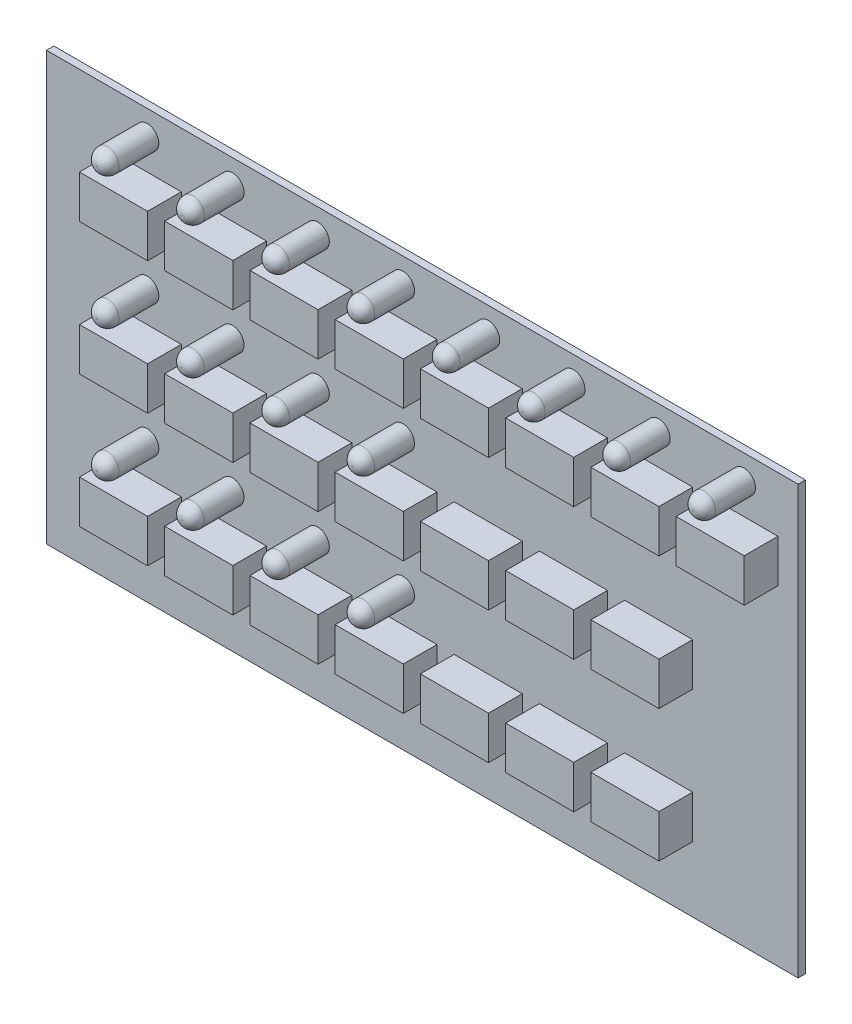
from build123d import *

# Parameters (mm, degrees)
SKETCH1_W                       = 162.5854
SKETCH1_H                       = 92.5068
BOARD_DEPTH                     = 1.592072
SKETCH17_R                      = 2.5
LED_KINGBRIGHT_3P_2P54_16_DEPTH = 11
FILLET1_R                       = 2.4
SKETCH18_W                      = 14.732
SKETCH18_H                      = 9.271
SWITCH_MCDTS2_1_DEPTH           = 7.3000108
SKETCH19_W                      = 14.732
SKETCH19_H                      = 9.271
SWITCH_MCDTS2_2_DEPTH           = 7.3000108
SKETCH20_W                      = 14.732
SKETCH20_H                      = 9.271
SWITCH_MCDTS2_3_DEPTH           = 7.3000108
SKETCH21_W                      = 14.732
SKETCH21_H                      = 9.271
SWITCH_MCDTS2_4_DEPTH           = 7.3000108
SKETCH22_W                      = 14.732
SKETCH22_H                      = 9.271
SWITCH_MCDTS2_5_DEPTH           = 7.3000108
SKETCH23_W                      = 14.732
SKETCH23_H                      = 9.271
SWITCH_MCDTS2_6_DEPTH           = 7.3000108
SKETCH24_W                      = 14.732
SKETCH24_H                      = 9.271
SWITCH_MCDTS2_7_DEPTH           = 7.3000108
SKETCH25_W                      = 14.732
SKETCH25_H                      = 9.271
SWITCH_MCDTS2_8_DEPTH           = 7.3000108
SKETCH26_W                      = 14.732
SKETCH26_H                      = 9.271
SWITCH_MCDTS2_9_DEPTH           = 7.3000108
SKETCH27_W                      = 14.732
SKETCH27_H                      = 9.271
SWITCH_MCDTS2_10_DEPTH          = 7.3000108
SKETCH28_W                      = 14.732
SKETCH28_H                      = 9.271
SWITCH_MCDTS2_11_DEPTH          = 7.3000108
SKETCH29_W                      = 14.732
SKETCH29_H                      = 9.271
SWITCH_MCDTS2_12_DEPTH          = 7.3000108
SKETCH30_W                      = 14.732
SKETCH30_H                      = 9.271
SWITCH_MCDTS2_13_DEPTH          = 7.3000108
SKETCH31_W                      = 14.732
SKETCH31_H                      = 9.271
SWITCH_MCDTS2_14_DEPTH          = 7.3000108
SKETCH32_W                      = 14.732
SKETCH32_H                      = 9.271
SWITCH_MCDTS2_15_DEPTH          = 7.3000108
SKETCH33_W                      = 14.732
SKETCH33_H                      = 9.271
SWITCH_MCDTS2_16_DEPTH          = 7.3000108
SKETCH34_W                      = 14.732
SKETCH34_H                      = 9.271
SWITCH_MCDTS2_17_DEPTH          = 7.3000108
SKETCH35_W                      = 14.732
SKETCH35_H                      = 9.271
SWITCH_MCDTS2_18_DEPTH          = 7.3000108
SKETCH36_W                      = 14.732
SKETCH36_H                      = 9.271
SWITCH_MCDTS2_19_DEPTH          = 7.3000108
SKETCH37_W                      = 14.732
SKETCH37_H                      = 9.271
SWITCH_MCDTS2_20_DEPTH          = 7.3000108
SKETCH38_W                      = 14.732
SKETCH38_H                      = 9.271
SWITCH_MCDTS2_21_DEPTH          = 7.3000108
SKETCH39_W                      = 14.732
SKETCH39_H                      = 9.271
SWITCH_MCDTS2_22_DEPTH          = 7.3000108
LPATTERN1_COUNT                 = 8
LPATTERN1_PITCH                 = 18.4375044
LPATTERN1_COUNT_DIR2            = 3
LPATTERN1_PITCH_DIR2            = 28.575
FILLET1_OF_LPATTERN1_R          = 2.4


with BuildPart() as part:
    # Sketch1 → BOARD (new body)
    with BuildSketch(Plane.XY):
        with Locations((81.2927, 46.2534)):
            Rectangle(SKETCH1_W, SKETCH1_H)
    extrude(amount=BOARD_DEPTH)


with BuildPart() as body_2:
    # Sketch17 → LED-KINGBRIGHT_3P_2P54-16 (new body)
    with BuildSketch(Plane.XY.offset(1.592072)):
        with Locations((21.7932, 87.1728)):
            Circle(SKETCH17_R)
    led_kingbright_3p_2p54_16 = extrude(amount=LED_KINGBRIGHT_3P_2P54_16_DEPTH)

    # Fillet1
    fillet1_edges = [body_2.edges().sort_by_distance(p)[0] for p in [
        (19.2932, 87.1728, 12.592072),
    ]]
    fillet(fillet1_edges, radius=FILLET1_R)


with BuildPart() as body_3:
    # Sketch18 → SWITCH-MCDTS2-1 (new body)
    with BuildSketch(Plane.XY.offset(1.592072)):
        with Locations((132.4182264, 18.7833)):
            Rectangle(SKETCH18_W, SKETCH18_H)
    extrude(amount=SWITCH_MCDTS2_1_DEPTH)


with BuildPart() as body_4:
    # Sketch19 → SWITCH-MCDTS2-2 (new body)
    with BuildSketch(Plane.XY.offset(1.592072)):
        with Locations((113.980722, 18.7833)):
            Rectangle(SKETCH19_W, SKETCH19_H)
    extrude(amount=SWITCH_MCDTS2_2_DEPTH)


with BuildPart() as body_5:
    # Sketch20 → SWITCH-MCDTS2-3 (new body)
    with BuildSketch(Plane.XY.offset(1.592072)):
        with Locations((95.5432176, 18.7833)):
            Rectangle(SKETCH20_W, SKETCH20_H)
    extrude(amount=SWITCH_MCDTS2_3_DEPTH)


with BuildPart() as body_6:
    # Sketch21 → SWITCH-MCDTS2-4 (new body)
    with BuildSketch(Plane.XY.offset(1.592072)):
        with Locations((77.1057132, 18.7833)):
            Rectangle(SKETCH21_W, SKETCH21_H)
    extrude(amount=SWITCH_MCDTS2_4_DEPTH)


with BuildPart() as body_7:
    # Sketch22 → SWITCH-MCDTS2-5 (new body)
    with BuildSketch(Plane.XY.offset(1.592072)):
        with Locations((58.6682088, 18.7833)):
            Rectangle(SKETCH22_W, SKETCH22_H)
    extrude(amount=SWITCH_MCDTS2_5_DEPTH)


with BuildPart() as body_8:
    # Sketch23 → SWITCH-MCDTS2-6 (new body)
    with BuildSketch(Plane.XY.offset(1.592072)):
        with Locations((40.2307044, 18.7833)):
            Rectangle(SKETCH23_W, SKETCH23_H)
    extrude(amount=SWITCH_MCDTS2_6_DEPTH)


with BuildPart() as body_9:
    # Sketch24 → SWITCH-MCDTS2-7 (new body)
    with BuildSketch(Plane.XY.offset(1.592072)):
        with Locations((21.7932, 18.7833)):
            Rectangle(SKETCH24_W, SKETCH24_H)
    extrude(amount=SWITCH_MCDTS2_7_DEPTH)


with BuildPart() as body_10:
    # Sketch25 → SWITCH-MCDTS2-8 (new body)
    with BuildSketch(Plane.XY.offset(1.592072)):
        with Locations((132.4182264, 47.3583)):
            Rectangle(SKETCH25_W, SKETCH25_H)
    extrude(amount=SWITCH_MCDTS2_8_DEPTH)


with BuildPart() as body_11:
    # Sketch26 → SWITCH-MCDTS2-9 (new body)
    with BuildSketch(Plane.XY.offset(1.592072)):
        with Locations((113.980722, 47.3583)):
            Rectangle(SKETCH26_W, SKETCH26_H)
    extrude(amount=SWITCH_MCDTS2_9_DEPTH)


with BuildPart() as body_12:
    # Sketch27 → SWITCH-MCDTS2-10 (new body)
    with BuildSketch(Plane.XY.offset(1.592072)):
        with Locations((95.5432176, 47.3583)):
            Rectangle(SKETCH27_W, SKETCH27_H)
    extrude(amount=SWITCH_MCDTS2_10_DEPTH)


with BuildPart() as body_13:
    # Sketch28 → SWITCH-MCDTS2-11 (new body)
    with BuildSketch(Plane.XY.offset(1.592072)):
        with Locations((77.1057132, 47.3583)):
            Rectangle(SKETCH28_W, SKETCH28_H)
    extrude(amount=SWITCH_MCDTS2_11_DEPTH)


with BuildPart() as body_14:
    # Sketch29 → SWITCH-MCDTS2-12 (new body)
    with BuildSketch(Plane.XY.offset(1.592072)):
        with Locations((58.6682088, 47.3583)):
            Rectangle(SKETCH29_W, SKETCH29_H)
    extrude(amount=SWITCH_MCDTS2_12_DEPTH)


with BuildPart() as body_15:
    # Sketch30 → SWITCH-MCDTS2-13 (new body)
    with BuildSketch(Plane.XY.offset(1.592072)):
        with Locations((40.2307044, 47.3583)):
            Rectangle(SKETCH30_W, SKETCH30_H)
    extrude(amount=SWITCH_MCDTS2_13_DEPTH)


with BuildPart() as body_16:
    # Sketch31 → SWITCH-MCDTS2-14 (new body)
    with BuildSketch(Plane.XY.offset(1.592072)):
        with Locations((21.7932, 47.3583)):
            Rectangle(SKETCH31_W, SKETCH31_H)
    extrude(amount=SWITCH_MCDTS2_14_DEPTH)


with BuildPart() as body_17:
    # Sketch32 → SWITCH-MCDTS2-15 (new body)
    with BuildSketch(Plane.XY.offset(1.592072)):
        with Locations((150.8557308, 75.9333)):
            Rectangle(SKETCH32_W, SKETCH32_H)
    extrude(amount=SWITCH_MCDTS2_15_DEPTH)


with BuildPart() as body_18:
    # Sketch33 → SWITCH-MCDTS2-16 (new body)
    with BuildSketch(Plane.XY.offset(1.592072)):
        with Locations((132.4182264, 75.9333)):
            Rectangle(SKETCH33_W, SKETCH33_H)
    extrude(amount=SWITCH_MCDTS2_16_DEPTH)


with BuildPart() as body_19:
    # Sketch34 → SWITCH-MCDTS2-17 (new body)
    with BuildSketch(Plane.XY.offset(1.592072)):
        with Locations((113.980722, 75.9333)):
            Rectangle(SKETCH34_W, SKETCH34_H)
    extrude(amount=SWITCH_MCDTS2_17_DEPTH)


with BuildPart() as body_20:
    # Sketch35 → SWITCH-MCDTS2-18 (new body)
    with BuildSketch(Plane.XY.offset(1.592072)):
        with Locations((95.5432176, 75.9333)):
            Rectangle(SKETCH35_W, SKETCH35_H)
    extrude(amount=SWITCH_MCDTS2_18_DEPTH)


with BuildPart() as body_21:
    # Sketch36 → SWITCH-MCDTS2-19 (new body)
    with BuildSketch(Plane.XY.offset(1.592072)):
        with Locations((77.1057132, 75.9333)):
            Rectangle(SKETCH36_W, SKETCH36_H)
    extrude(amount=SWITCH_MCDTS2_19_DEPTH)


with BuildPart() as body_22:
    # Sketch37 → SWITCH-MCDTS2-20 (new body)
    with BuildSketch(Plane.XY.offset(1.592072)):
        with Locations((58.6682088, 75.9333)):
            Rectangle(SKETCH37_W, SKETCH37_H)
    extrude(amount=SWITCH_MCDTS2_20_DEPTH)


with BuildPart() as body_23:
    # Sketch38 → SWITCH-MCDTS2-21 (new body)
    with BuildSketch(Plane.XY.offset(1.592072)):
        with Locations((40.2307044, 75.9333)):
            Rectangle(SKETCH38_W, SKETCH38_H)
    extrude(amount=SWITCH_MCDTS2_21_DEPTH)


with BuildPart() as body_24:
    # Sketch39 → SWITCH-MCDTS2-22 (new body)
    with BuildSketch(Plane.XY.offset(1.592072)):
        with Locations((21.7932, 75.9333)):
            Rectangle(SKETCH39_W, SKETCH39_H)
    extrude(amount=SWITCH_MCDTS2_22_DEPTH)


with BuildPart() as part_1:
    add(part.part)

    # LPattern1: LED-KINGBRIGHT_3P_2P54-16 8 × 3, 8 skipped
    with Locations(*[(i * LPATTERN1_PITCH, -j * LPATTERN1_PITCH_DIR2, 0) for i in range(LPATTERN1_COUNT) for j in range(LPATTERN1_COUNT_DIR2) if (i, j) not in ((0, 0), (4, 1), (4, 2), (5, 1), (5, 2), (6, 1), (6, 2), (7, 1), (7, 2))]):
        add(led_kingbright_3p_2p54_16)

    # Fillet1 of LPattern1
    fillet1_of_lpattern1_edges = [part_1.edges().sort_by_distance(p)[0] for p in [
        (19.2932, 58.5978, 12.592072),
        (19.2932, 30.0228, 12.592072),
        (37.7307044, 87.1728, 12.592072),
        (37.7307044, 58.5978, 12.592072),
        (37.7307044, 30.0228, 12.592072),
        (56.1682088, 87.1728, 12.592072),
        (56.1682088, 58.5978, 12.592072),
        (56.1682088, 30.0228, 12.592072),
        (74.6057132, 87.1728, 12.592072),
        (74.6057132, 58.5978, 12.592072),
        (74.6057132, 30.0228, 12.592072),
        (93.0432176, 87.1728, 12.592072),
        (111.480722, 87.1728, 12.592072),
        (129.9182264, 87.1728, 12.592072),
        (148.3557308, 87.1728, 12.592072),
    ]]
    fillet(fillet1_of_lpattern1_edges, radius=FILLET1_OF_LPATTERN1_R)


solid = Compound([body_2.part, body_3.part, body_4.part, body_5.part, body_6.part, body_7.part, body_8.part, body_9.part, body_10.part, body_11.part, body_12.part, body_13.part, body_14.part, body_15.part, body_16.part, body_17.part, body_18.part, body_19.part, body_20.part, body_21.part, body_22.part, body_23.part, body_24.part, part_1.part])
